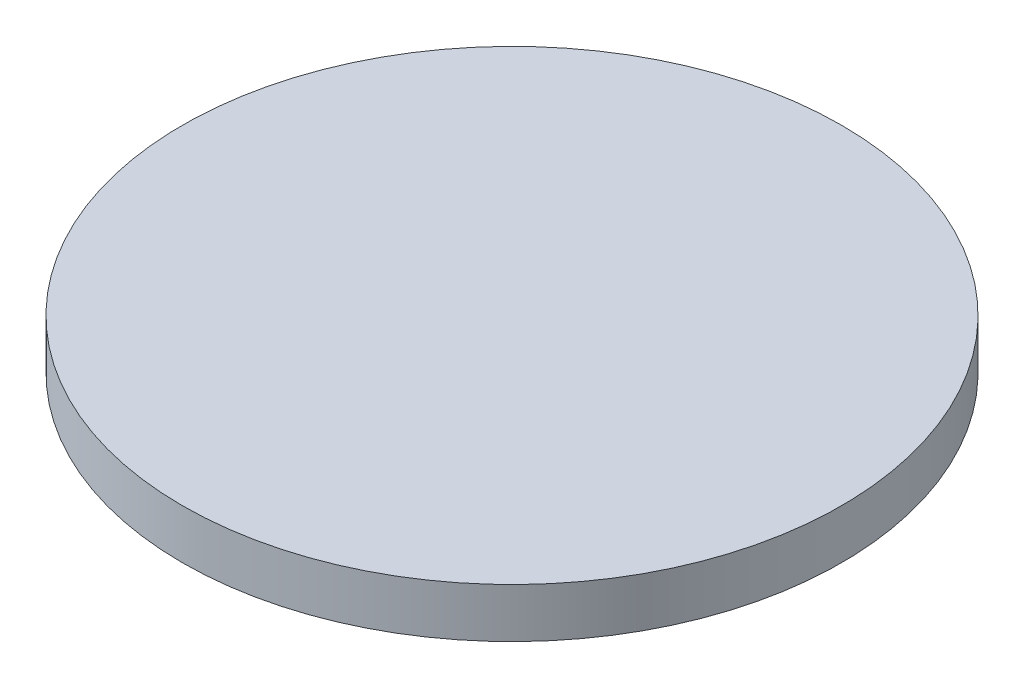
from build123d import *

# Parameters (mm, degrees)
SKETCH_1_R        = 20
EXTRUDE_220_DEPTH = 3


with BuildPart() as part:
    # Эскиз1 → Extrude 220 (new body)
    with BuildSketch(Plane(origin=(0, 0, 0), x_dir=(1, 0, 0), z_dir=(0, 1, 0))):
        with Locations(Location((0, 0, 0), (0, 0, 270))):
            Circle(SKETCH_1_R)
    extrude(amount=EXTRUDE_220_DEPTH)


solid = part.part
